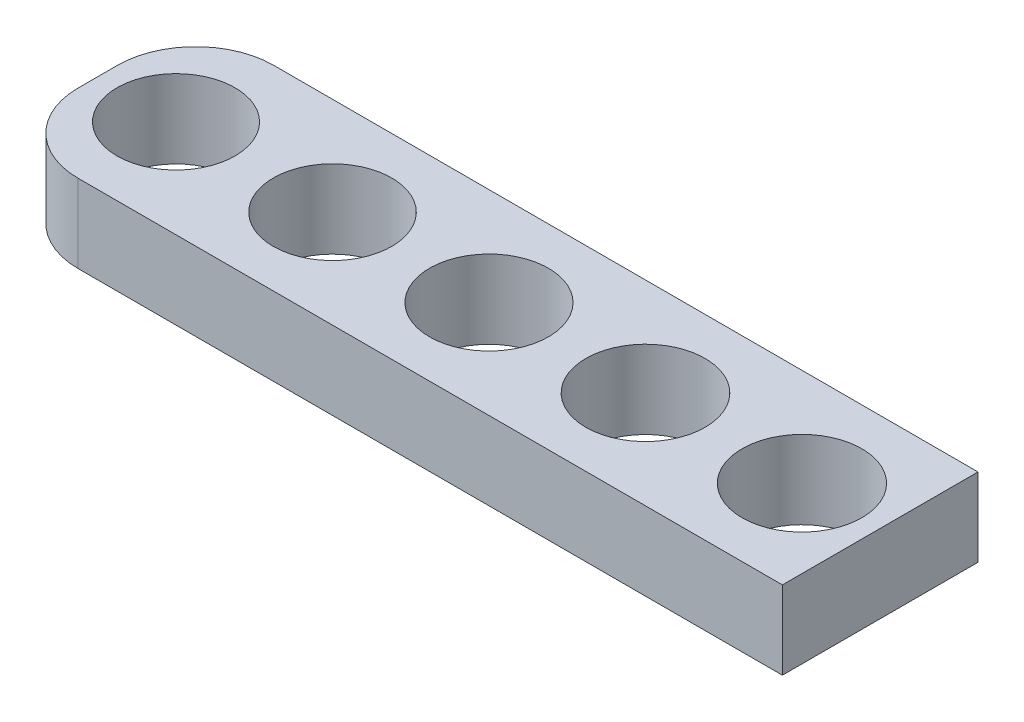
from build123d import *

# Parameters (mm, degrees)
SKETCH1_R           = 7.55
SKETCH1_R_2         = 7.575
SKETCH1_R_3         = 7.6
SKETCH1_R_4         = 7.625
SKETCH1_R_5         = 7.65
BOSS_EXTRUDE1_DEPTH = 10


with BuildPart() as part:
    # Sketch1 → Boss-Extrude1 (new body)
    with BuildSketch(Plane(origin=(0, 0, 0), x_dir=(1, 0, 0), z_dir=(0, 1, 0))):
        with BuildLine():
            Line((-40, 12.5), (50, 12.5))
            Line((50, 12.5), (50, -12.5))
            Line((50, -12.5), (-40, -12.5))
            ThreePointArc((-40, -12.5), (-47.071067812, -9.571067812), (-50, -2.5))
            Line((-50, -2.5), (-50, 2.5))
            ThreePointArc((-50, 2.5), (-47.071067812, 9.571067812), (-40, 12.5))
        make_face()
        with Locations(Location((-40, 0, 0), (0, 0, 270))):
            Circle(SKETCH1_R, mode=Mode.SUBTRACT)
        with Locations(Location((-20, 0, 0), (0, 0, 270))):
            Circle(SKETCH1_R_2, mode=Mode.SUBTRACT)
        with Locations(Location((0, 0, 0), (0, 0, 270))):
            Circle(SKETCH1_R_3, mode=Mode.SUBTRACT)
        with Locations(Location((20, 0, 0), (0, 0, 270))):
            Circle(SKETCH1_R_4, mode=Mode.SUBTRACT)
        with Locations(Location((40, 0, 0), (0, 0, 270))):
            Circle(SKETCH1_R_5, mode=Mode.SUBTRACT)
    extrude(amount=BOSS_EXTRUDE1_DEPTH)


solid = part.part
